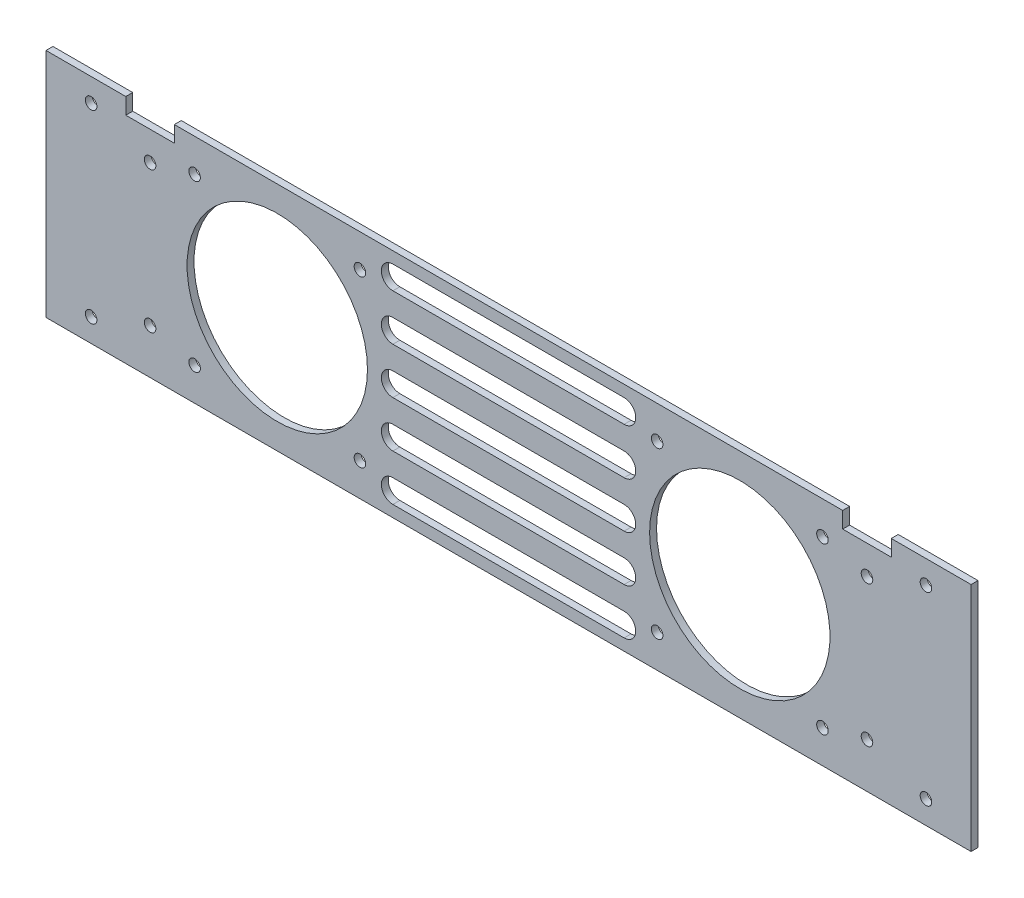
from build123d import *

# Parameters (mm, degrees)
SKETCH1_W           = 400
SKETCH1_H           = 100
BOSS_EXTRUDE1_DEPTH = 3
SKETCH2_R           = 2.5
SKETCH2_R_2         = 39
CUT_EXTRUDE1_DEPTH  = 207.177108332
CUT_EXTRUDE2_DEPTH  = 207.177108332
CUT_EXTRUDE3_REACH  = 208.177
SKETCH4_R           = 2.5
SKETCH5_R           = 2.5
CUT_EXTRUDE4_DEPTH  = 207.177108332
CUT_EXTRUDE5_REACH  = 208.177
SKETCH6_W           = 21
SKETCH6_H           = 7


with BuildPart() as part:
    # Sketch1 → Boss-Extrude1 (new body)
    with BuildSketch(Plane.XY):
        Rectangle(SKETCH1_W, SKETCH1_H)
    extrude(amount=BOSS_EXTRUDE1_DEPTH)

    # Sketch2 → Cut-Extrude1 (cut, through all)
    with BuildSketch(Plane.XY.offset(3)):
        with Locations((-64.25, 35.75)):
            Circle(SKETCH2_R)
        with Locations((-64.25, -35.75)):
            Circle(SKETCH2_R)
        with Locations((-135.75, -35.75)):
            Circle(SKETCH2_R)
        with Locations((-135.75, 35.75)):
            Circle(SKETCH2_R)
        with Locations((-100, 0)):
            Circle(SKETCH2_R_2)
        with Locations(Location((100, 0, 0), (0, 0, 180))):
            Circle(SKETCH2_R_2)
        with Locations(Location((135.75, 35.75, 0), (0, 0, 180))):
            Circle(SKETCH2_R)
        with Locations(Location((135.75, -35.75, 0), (0, 0, 180))):
            Circle(SKETCH2_R)
        with Locations(Location((64.25, -35.75, 0), (0, 0, 180))):
            Circle(SKETCH2_R)
        with Locations(Location((64.25, 35.75, 0), (0, 0, 180))):
            Circle(SKETCH2_R)
    extrude(amount=-CUT_EXTRUDE1_DEPTH, mode=Mode.SUBTRACT)

    # Sketch3 → Cut-Extrude2 (cut, through all)
    with BuildSketch(Plane.XY.offset(3)):
        with BuildLine():
            Line((-50, 5), (50, 5))
            ThreePointArc((50, 5), (55, 0), (50, -5))
            Line((50, -5), (-50, -5))
            ThreePointArc((-50, -5), (-55, 0), (-50, 5))
        make_face()
        with BuildLine():
            Line((-50, 25), (50, 25))
            ThreePointArc((50, 25), (55, 20), (50, 15))
            Line((50, 15), (-50, 15))
            ThreePointArc((-50, 15), (-55, 20), (-50, 25))
        make_face()
        with BuildLine():
            Line((-50, 45), (50, 45))
            ThreePointArc((50, 45), (55, 40), (50, 35))
            Line((50, 35), (-50, 35))
            ThreePointArc((-50, 35), (-55, 40), (-50, 45))
        make_face()
        with BuildLine():
            Line((-50, -45), (50, -45))
            ThreePointArc((50, -45), (55, -40), (50, -35))
            Line((50, -35), (-50, -35))
            ThreePointArc((-50, -35), (-55, -40), (-50, -45))
        make_face()
        with BuildLine():
            Line((-50, -25), (50, -25))
            ThreePointArc((50, -25), (55, -20), (50, -15))
            Line((50, -15), (-50, -15))
            ThreePointArc((-50, -15), (-55, -20), (-50, -25))
        make_face()
    extrude(amount=-CUT_EXTRUDE2_DEPTH, mode=Mode.SUBTRACT)

    # Sketch4 → Cut-Extrude3 (cut, up to next)
    with BuildSketch(Plane.XY.offset(3), mode=Mode.PRIVATE) as cut_extrude3_sk1:
        with Locations((-155, -30.5)):
            Circle(SKETCH4_R)
    cut_extrude3_tool1 = extrude(cut_extrude3_sk1.sketch, amount=-CUT_EXTRUDE3_REACH, mode=Mode.PRIVATE) & part.part
    # Sketch4 → Cut-Extrude3 (cut, up to next)
    with BuildSketch(Plane.XY.offset(3), mode=Mode.PRIVATE) as cut_extrude3_sk2:
        with Locations((-155, 30.5)):
            Circle(SKETCH4_R)
    cut_extrude3_tool2 = extrude(cut_extrude3_sk2.sketch, amount=-CUT_EXTRUDE3_REACH, mode=Mode.PRIVATE) & part.part
    # Sketch4 → Cut-Extrude3 (cut, up to next)
    with BuildSketch(Plane.XY.offset(3), mode=Mode.PRIVATE) as cut_extrude3_sk3:
        with Locations((155, 30.5)):
            Circle(SKETCH4_R)
    cut_extrude3_tool3 = extrude(cut_extrude3_sk3.sketch, amount=-CUT_EXTRUDE3_REACH, mode=Mode.PRIVATE) & part.part
    # Sketch4 → Cut-Extrude3 (cut, up to next)
    with BuildSketch(Plane.XY.offset(3), mode=Mode.PRIVATE) as cut_extrude3_sk4:
        with Locations((155, -30.5)):
            Circle(SKETCH4_R)
    cut_extrude3_tool4 = extrude(cut_extrude3_sk4.sketch, amount=-CUT_EXTRUDE3_REACH, mode=Mode.PRIVATE) & part.part
    add(cut_extrude3_tool1.solids().sort_by_distance((-155, -30.5, 3))[0], mode=Mode.SUBTRACT)
    add(cut_extrude3_tool2.solids().sort_by_distance((-155, 30.5, 3))[0], mode=Mode.SUBTRACT)
    add(cut_extrude3_tool3.solids().sort_by_distance((155, 30.5, 3))[0], mode=Mode.SUBTRACT)
    add(cut_extrude3_tool4.solids().sort_by_distance((155, -30.5, 3))[0], mode=Mode.SUBTRACT)

    # Sketch5 → Cut-Extrude4 (cut, through all)
    with BuildSketch(Plane.XY.offset(3)):
        with Locations((-180.5, -40)):
            Circle(SKETCH5_R)
        with Locations((-180.5, 40)):
            Circle(SKETCH5_R)
        with Locations(Location((180.5, 40, 0), (0, 0, 180))):
            Circle(SKETCH5_R)
        with Locations(Location((180.5, -40, 0), (0, 0, 180))):
            Circle(SKETCH5_R)
    extrude(amount=-CUT_EXTRUDE4_DEPTH, mode=Mode.SUBTRACT)

    # Sketch6 → Cut-Extrude5 (cut, up to next)
    with BuildSketch(Plane.XY.offset(3), mode=Mode.PRIVATE) as cut_extrude5_sk1:
        with Locations((-155, 46.5)):
            Rectangle(SKETCH6_W, SKETCH6_H)
    cut_extrude5_tool1 = extrude(cut_extrude5_sk1.sketch, amount=-CUT_EXTRUDE5_REACH, mode=Mode.PRIVATE) & part.part
    # Sketch6 → Cut-Extrude5 (cut, up to next)
    with BuildSketch(Plane.XY.offset(3), mode=Mode.PRIVATE) as cut_extrude5_sk2:
        with Locations((155, 46.5)):
            Rectangle(SKETCH6_W, SKETCH6_H)
    cut_extrude5_tool2 = extrude(cut_extrude5_sk2.sketch, amount=-CUT_EXTRUDE5_REACH, mode=Mode.PRIVATE) & part.part
    add(cut_extrude5_tool1.solids().sort_by_distance((-155, 46.5, 3))[0], mode=Mode.SUBTRACT)
    add(cut_extrude5_tool2.solids().sort_by_distance((155, 46.5, 3))[0], mode=Mode.SUBTRACT)


solid = part.part
